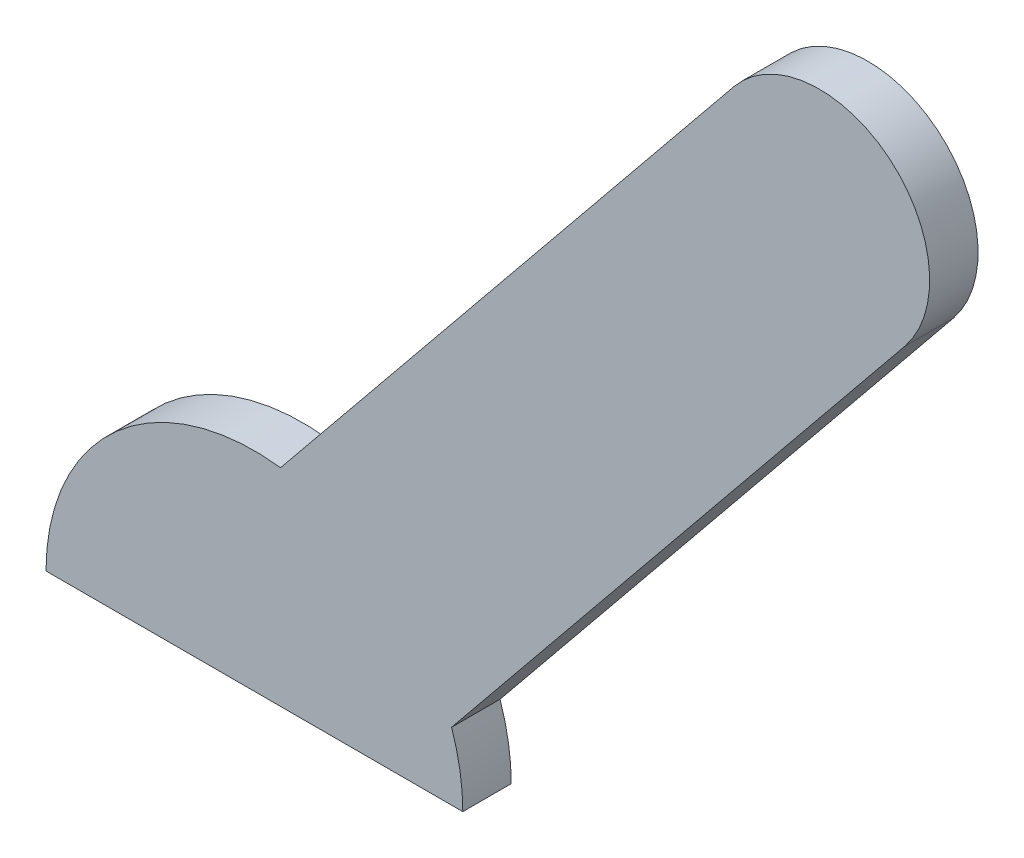
from build123d import *

# Parameters (mm, degrees)
BOSS_EXTRUDE2_DEPTH = 2.54


with BuildPart() as part:
    # Sketch1 → Boss-Extrude2 (new body)
    with BuildSketch(Plane.XY):
        with BuildLine():
            Line((-10.926168191, 0), (10.926168191, 0))
            ThreePointArc((10.926168191, 0), (10.777925696, 1.79373048), (10.337220817, 3.538787522))
            Line((10.337220817, 3.538787522), (34.102376068, 32.722470445))
            ThreePointArc((34.102376068, 32.722470445), (33.270057491, 40.855731781), (25.136796156, 40.023413204))
            Line((25.136796156, 40.023413204), (1.371640905, 10.839730281))
            ThreePointArc((1.371640905, 10.839730281), (-7.224762007, 8.196582537), (-10.926168191, 0))
        make_face()
    extrude(amount=BOSS_EXTRUDE2_DEPTH)


solid = part.part
